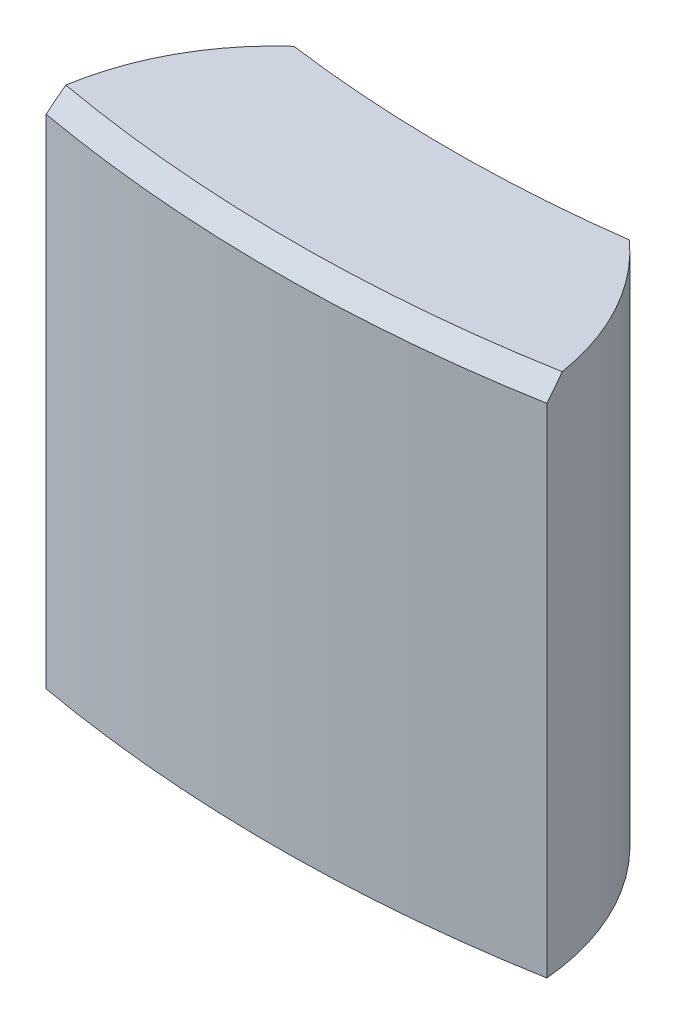
from build123d import *

# Parameters (mm, degrees)
BOSS_EXTRUDE1_DEPTH = 10.9
CHAMFER1_SIZE       = 1
SKETCH2_R           = 39.716531346
CUT_EXTRUDE1_DEPTH  = 0.65


with BuildPart() as part:
    # Sketch1 → Boss-Extrude1 (new body)
    with BuildSketch(Plane(origin=(0, 0, 0), x_dir=(1, 0, 0), z_dir=(0, 1, 0))):
        with BuildLine():
            ThreePointArc((-3.336791258, -24.776315789), (0, -25), (3.336791258, -24.776315789))
            ThreePointArc((3.336791258, -24.776315789), (4.47137835, -26.262417453), (4.980726164, -28.061403509))
            ThreePointArc((4.980726164, -28.061403509), (0, -28.5), (-4.980726164, -28.061403509))
            ThreePointArc((-4.980726164, -28.061403509), (-4.47137835, -26.262417453), (-3.336791258, -24.776315789))
        make_face()
    extrude(amount=BOSS_EXTRUDE1_DEPTH)

    # Chamfer1
    chamfer1_edges = [part.edges().sort_by_distance(p)[0] for p in [
        (0, 10.9, 28.5),
    ]]
    chamfer(chamfer1_edges, length=CHAMFER1_SIZE)

    # Sketch2 → Cut-Extrude1 (cut)
    with BuildSketch(Plane(origin=(0, 10.9, 0), x_dir=(1, 0, 0), z_dir=(0, 1, 0))):
        Circle(SKETCH2_R)
    extrude(amount=-CUT_EXTRUDE1_DEPTH, mode=Mode.SUBTRACT)


solid = part.part
